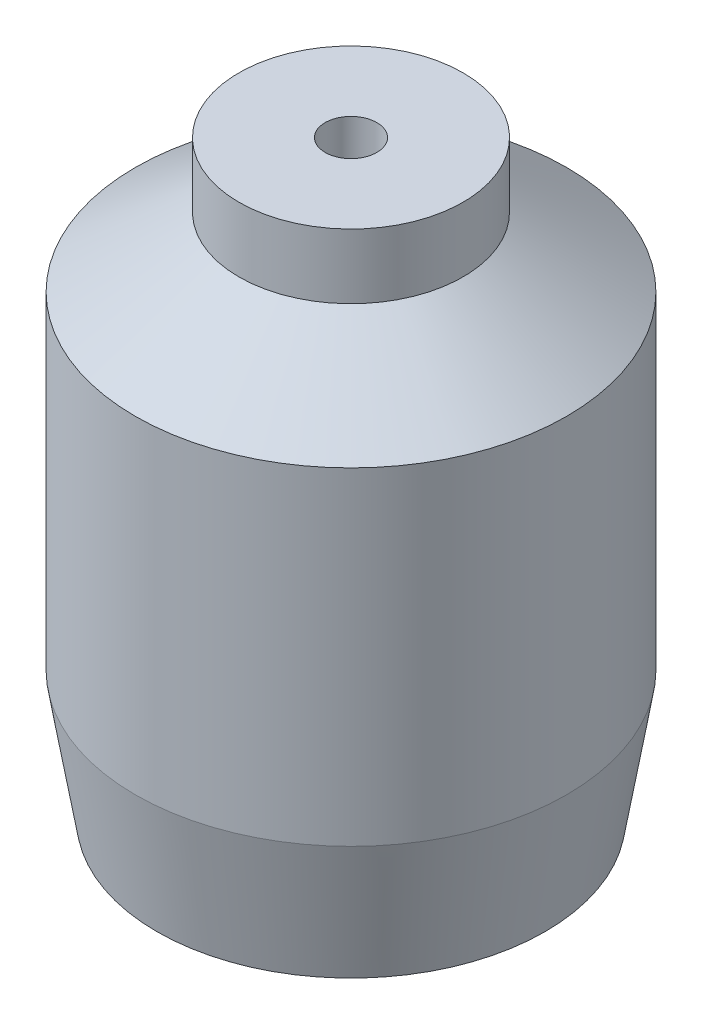
from build123d import *

# Parameters (mm, degrees)
SKETCH2_R          = 3
CUT_EXTRUDE1_DEPTH = 70


with BuildPart() as part:
    # Sketch1 → Revolve1 (revolve)
    with BuildSketch(Plane.XY, mode=Mode.PRIVATE) as revolve1_sk:
        Polygon((22.5, 0), (0, 0), (0, 68.5), (13, 68.5), (13, 61), (25, 53), (25, 15), align=None)
    revolve(revolve1_sk.sketch.rotate(Axis((0, 0, 0), (0, 1, 0)), 90), axis=Axis((0, 0, 0), (0, 1, 0)))

    # Sketch2 → Cut-Extrude1 (cut)
    with BuildSketch(Plane(origin=(0, 68.5, 0), x_dir=(1, 0, 0), z_dir=(0, 1, 0))):
        with Locations(Location((0, 0, 0), (0, 0, 270))):
            Circle(SKETCH2_R)
    extrude(amount=-CUT_EXTRUDE1_DEPTH, mode=Mode.SUBTRACT)


solid = part.part
